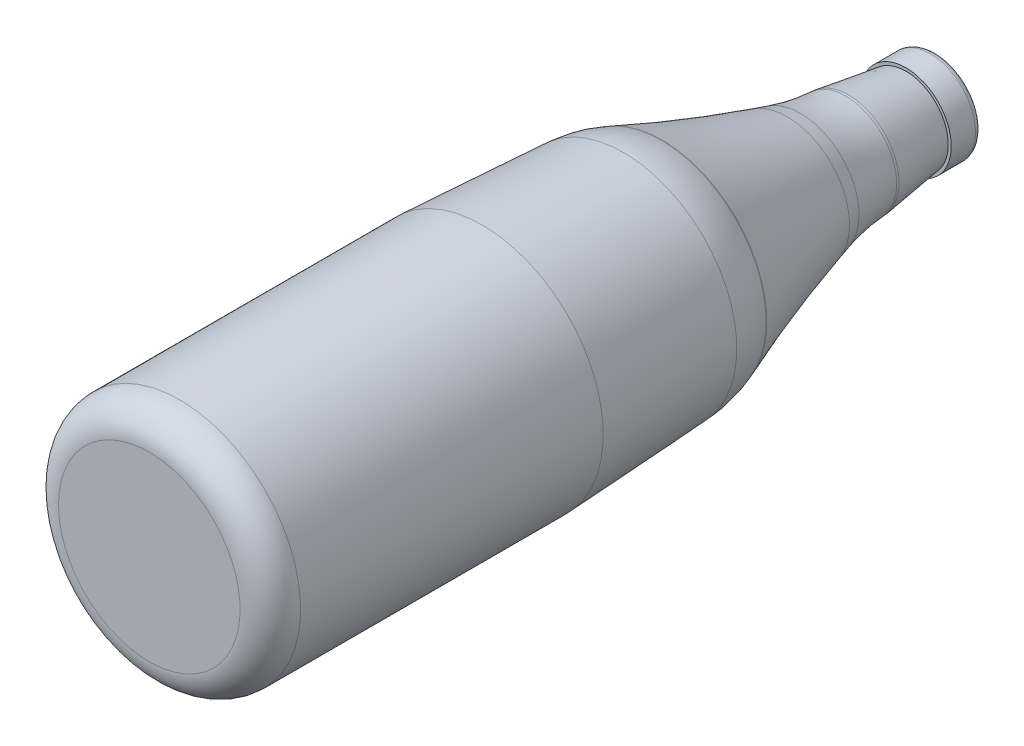
from build123d import *

# Parameters (mm, degrees)
FILLET1_R = 2


with BuildPart() as part:
    # Sketch1 → Revolve1 (revolve)
    with BuildSketch(Plane(origin=(0, 0, 0), x_dir=(1, 0, 0), z_dir=(0, 1, 0)), mode=Mode.PRIVATE) as revolve1_sk:
        with BuildLine():
            Line((0, 85.203744498), (15, 85.203744498))
            Line((15, 85.203744498), (15, 75.203744498))
            Line((15, 75.203744498), (14, 75.203744498))
            Line((14, 75.203744498), (16.755430859, 56.187296855))
            Line((16.755430859, 56.187296855), (16.805273968, 55.355672424))
            ThreePointArc((16.805273968, 55.355672424), (17.674850572, 47.783264008), (19.362594994, 40.350293442))
            Line((19.362594994, 40.350293442), (20.614214842, 35.960443447))
            ThreePointArc((20.614214842, 35.960443447), (27.100498023, 15.138305045), (34.588001623, -5.345117691))
            Line((34.588001623, -5.345117691), (34.711447428, -5.659018669))
            ThreePointArc((34.711447428, -5.659018669), (36.566659948, -11.769202622), (37.425911626, -18.096749382))
            Line((37.425911626, -18.096749382), (40, -64.796255502))
            Line((40, -64.796255502), (40, -164.796255502))
            ThreePointArc((40, -164.796255502), (37.071067812, -171.867323314), (30, -174.796255502))
            Line((30, -174.796255502), (0, -174.796255502))
            Line((0, -174.796255502), (0, 85.203744498))
        make_face()
    revolve(revolve1_sk.sketch.rotate(Axis((0, 0, -47.713129303), (0, 0, 1)), 180), axis=Axis((0, 0, -47.713129303), (0, 0, 1)))

    # Fillet1
    fillet1_edges = [part.edges().sort_by_distance(p)[0] for p in [
        (15, 0, -85.203744498),
    ]]
    fillet(fillet1_edges, radius=FILLET1_R)


solid = part.part
